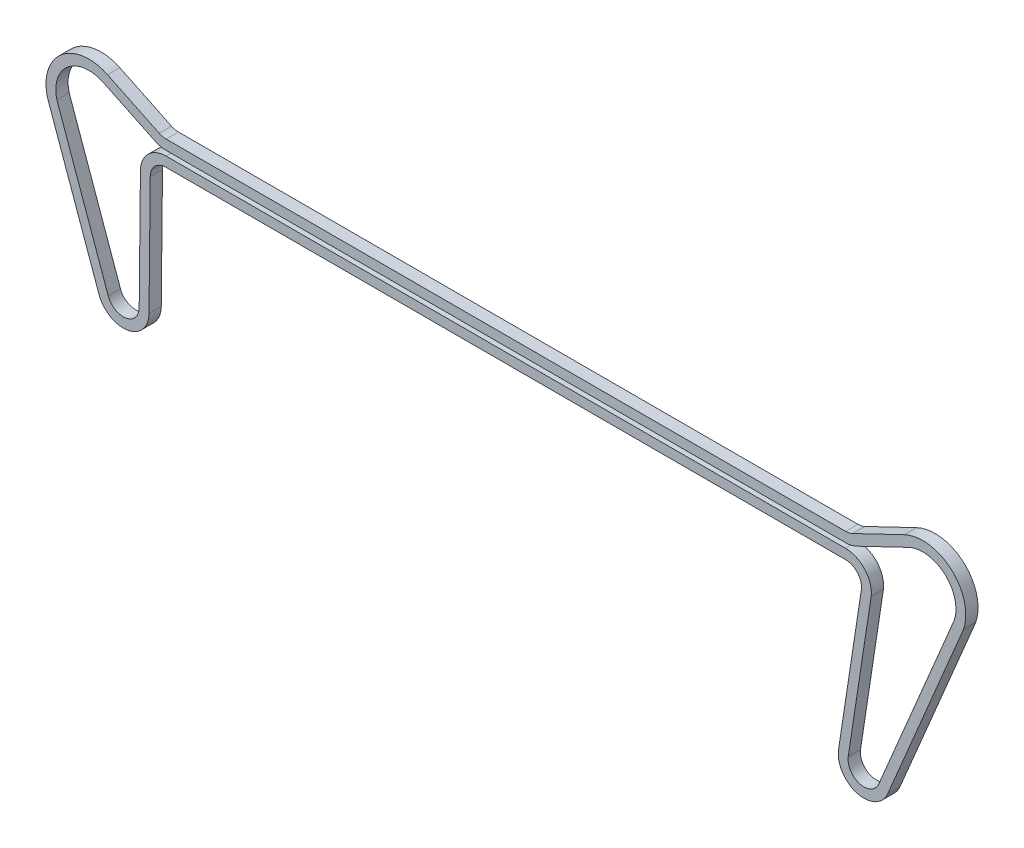
from build123d import *

# Parameters (mm, degrees)
BOSS_EXTRUDE1_DEPTH = 5


with BuildPart() as part:
    # Sketch1 → Boss-Extrude1 (new body)
    with BuildSketch(Plane(origin=(0, 0, -5), x_dir=(-1, 0, 0), z_dir=(0, 0, -1))):
        with BuildLine():
            Line((-25.000007614, -11.509619935), (-24.499994503, -60.010855227))
            ThreePointArc((-24.499994503, -60.010855227), (-15.782590077, -70.347575927), (-4.10890071, -63.523653936))
            Line((-4.10890071, -63.523653936), (16.891801465, -4.573510965))
            ThreePointArc((16.891801465, -4.573510965), (11.190796465, 13.454223259), (-7.573775299, 15.776184877))
            Line((-7.573775299, 15.776184877), (-28.686884347, 5.640277106))
            ThreePointArc((-28.686884347, 5.640277106), (-30.057470291, 5.16209183), (-31.500000671, 5.000002061))
            Line((-31.500000671, 5.000002061), (-308.500000671, 5.000002061))
            ThreePointArc((-308.500000671, 5.000002061), (-309.942531001, 5.162091818), (-311.313116903, 5.640277062))
            Line((-311.313116903, 5.640277062), (-332.426226108, 15.776184506))
            ThreePointArc((-332.426226108, 15.776184506), (-351.584092911, 13.117120589), (-356.591608654, -5.564936777))
            Line((-356.591608654, -5.564936777), (-325.67891256, -79.070456081))
            ThreePointArc((-325.67891256, -79.070456081), (-313.151079009, -85.106115073), (-305.620183213, -73.415888323))
            Line((-305.620183213, -73.415888323), (-314.961196041, -12.209189089))
            ThreePointArc((-314.961196041, -12.209189089), (-313.340441716, -7.161780706), (-308.500000492, -4.999997939))
            Line((-308.500000492, -4.999997939), (-31.500000492, -4.999997939))
            ThreePointArc((-31.500000492, -4.999997939), (-26.900405783, -6.907207011), (-25.000007614, -11.509619935))
        make_face()
        with BuildLine():
            Line((-31.500000492, -0.999997939), (-308.500000492, -0.999997939))
            ThreePointArc((-308.500000492, -0.999997939), (-316.350566349, -4.527292887), (-318.926606245, -12.739309227))
            Line((-318.926606245, -12.739309227), (-309.574399245, -74.019357929))
            ThreePointArc((-309.574399245, -74.019357929), (-314.236382275, -81.256164837), (-321.991707669, -77.519804575))
            Line((-321.991707669, -77.519804575), (-352.84288251, -4.160573117))
            ThreePointArc((-352.84288251, -4.160573117), (-348.883942975, 10.16492029), (-334.157374559, 12.170199891))
            Line((-334.157374559, 12.170199891), (-313.044265354, 2.034292448))
            ThreePointArc((-313.044265354, 2.034292448), (-310.830241974, 1.261839361), (-308.500000671, 1.000002061))
            Line((-308.500000671, 1.000002061), (-31.500000671, 1.000002061))
            ThreePointArc((-31.500000671, 1.000002061), (-29.169759288, 1.261839379), (-26.95573584, 2.034292518))
            Line((-26.95573584, 2.034292518), (-5.842626792, 12.170200289))
            ThreePointArc((-5.842626792, 12.170200289), (8.576792018, 10.425386169), (13.068119724, -3.387361226))
            Line((13.068119724, -3.387361226), (-7.876938579, -62.181308743))
            ThreePointArc((-7.876938579, -62.181308743), (-15.111557007, -66.404249616), (-20.499993004, -59.990382536))
            Line((-20.499993004, -59.990382536), (-21.000006097, -11.489149069))
            ThreePointArc((-21.000006097, -11.489149069), (-24.079215936, -4.071542072), (-31.500000492, -0.999997939))
        make_face(mode=Mode.SUBTRACT)
    extrude(amount=-BOSS_EXTRUDE1_DEPTH)


solid = part.part
